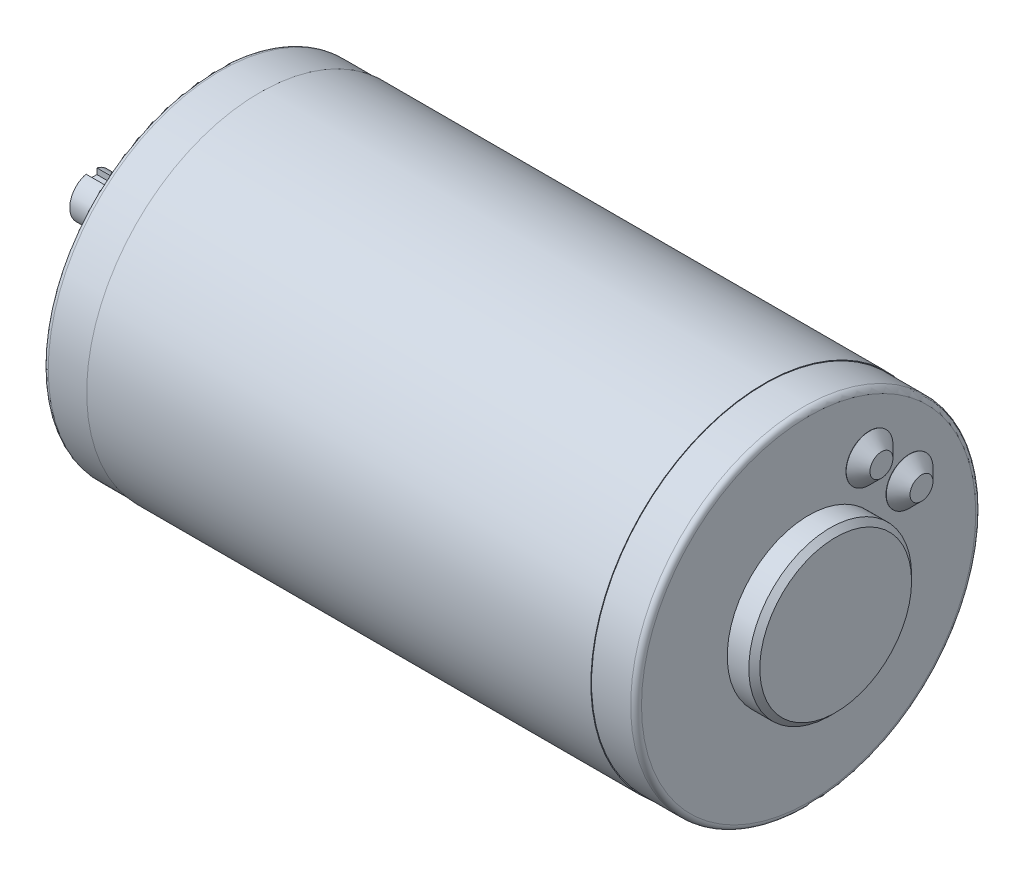
from build123d import *

# Parameters (mm, degrees)
SKETCH1_W                  = 93.1408
SKETCH1_H                  = 32.004
SKETCH2_R                  = 31.877
BOSS_EXTRUDE1_DEPTH        = 8.2296
SKETCH3_R                  = 15.0368
BOSS_EXTRUDE2_DEPTH        = 3.984
SKETCH4_R                  = 15.0368
BOSS_EXTRUDE3_DEPTH        = 1.016
BOSS_EXTRUDE3_TAPER        = 45
BOSS_EXTRUDE4_START        = 8.2296
SKETCH5_R                  = 31.877
BOSS_EXTRUDE4_DEPTH        = 8.2296
SKETCH6_R                  = 9.525
BOSS_EXTRUDE5_DEPTH        = 4
SKETCH7_R                  = 4
BOSS_EXTRUDE6_DEPTH        = 31.6
CUT_EXTRUDE1_REACH         = 125.971
CUT_EXTRUDE1_END_RADIUS    = 4
M3_5_CLEARANCE_HOLE1_D     = 4.0386
M3_5_CLEARANCE_HOLE1_DEPTH = 13.6144
M3_5_CLEARANCE_HOLE1_TIP   = 1.213317848
CHAMFER1_SIZE              = 1.016
CHAMFER2_SIZE              = 0.5
FILLET1_R                  = 1
CUT_EXTRUDE2_DEPTH         = 124.213928007
CUT_EXTRUDE2_DEPTH_BACK    = 124.213928007
SKETCH13_W                 = 12.7
SKETCH13_H                 = 41.153791371


with BuildPart() as part:
    # Sketch1 → Revolve1 (revolve)
    with BuildSketch(Plane.XY, mode=Mode.PRIVATE) as revolve1_sk:
        with Locations((54.8, 16.002)):
            Rectangle(SKETCH1_W, SKETCH1_H)
    revolve(revolve1_sk.sketch.rotate(Axis((8.2296, 0, 0), (1, 0, 0)), 270), axis=Axis((8.2296, 0, 0), (1, 0, 0)))

    # Sketch2 → Boss-Extrude1 (add)
    with BuildSketch(Plane(origin=(101.3704, 0, 0), x_dir=(0, 0, -1), z_dir=(1, 0, 0))):
        Circle(SKETCH2_R)
    extrude(amount=BOSS_EXTRUDE1_DEPTH)

    # Sketch3 → Boss-Extrude2 (add)
    with BuildSketch(Plane(origin=(109.6, 0, 0), x_dir=(0, 0, -1), z_dir=(1, 0, 0))):
        Circle(SKETCH3_R)
    extrude(amount=BOSS_EXTRUDE2_DEPTH)

    # Sketch4 → Boss-Extrude3 (add)
    with BuildSketch(Plane(origin=(113.584, 0, 0), x_dir=(0, 0, -1), z_dir=(1, 0, 0))):
        Circle(SKETCH4_R)
    extrude(amount=BOSS_EXTRUDE3_DEPTH, taper=BOSS_EXTRUDE3_TAPER)

    # Sketch5 → Boss-Extrude4 (add)
    with BuildSketch(Plane.ZY.offset(-8.2296).offset(BOSS_EXTRUDE4_START)):
        with Locations(Location((0, 0, 0), (0, 0, 180))):
            Circle(SKETCH5_R)
    extrude(amount=-BOSS_EXTRUDE4_DEPTH)

    # Sketch6 → Boss-Extrude5 (add)
    with BuildSketch(Plane.ZY):
        Circle(SKETCH6_R)
    extrude(amount=BOSS_EXTRUDE5_DEPTH)

    # Sketch7 → Boss-Extrude6 (add)
    with BuildSketch(Plane.ZY.offset(4)):
        Circle(SKETCH7_R)
    extrude(amount=BOSS_EXTRUDE6_DEPTH)

    # Cut-Extrude1: up to this cylinder (the profile starts inside it)
    cut_extrude1_end = Plane(origin=(-16.85, 0, 0), z_dir=(1, 0, 0)) * Cylinder(CUT_EXTRUDE1_END_RADIUS, 260.942, mode=Mode.PRIVATE)
    # Sketch8 → Cut-Extrude1 (cut, up to the surface)
    with BuildSketch(Plane.XZ.offset(-2.8), mode=Mode.PRIVATE) as cut_extrude1_sk1:
        with BuildLine():
            Line((-7.1, 1), (-26.6, 1))
            ThreePointArc((-26.6, 1), (-27.6, 0), (-26.6, -1))
            Line((-26.6, -1), (-7.1, -1))
            ThreePointArc((-7.1, -1), (-6.1, 0), (-7.1, 1))
        make_face()
    cut_extrude1_tool1 = extrude(cut_extrude1_sk1.sketch, amount=-CUT_EXTRUDE1_REACH, mode=Mode.PRIVATE) & cut_extrude1_end
    add(cut_extrude1_tool1.solids().sort_by_distance((-16.85, 2.8, 0))[0], mode=Mode.SUBTRACT)

    # Sketch9 → Revolve2 (revolve)
    with BuildSketch(Plane.XY.offset(-18.607090683), mode=Mode.PRIVATE) as revolve2_sk:
        Polygon((109.6, 15.525359639), (109.6, 11.207359639), (111.8479, 11.207359639), (111.8479, 13.325359639), (109.6479, 15.525359639), align=None)
    revolve(revolve2_sk.sketch.rotate(Axis((109.6, 11.207359639, -18.607090683), (1, 0, 0)), 270), axis=Axis((109.6, 11.207359639, -18.607090683), (1, 0, 0)))

    # Sketch10 → Revolve3 (revolve)
    with BuildSketch(Plane.XY.offset(-11.207359639), mode=Mode.PRIVATE) as revolve3_sk:
        Polygon((109.6, 22.925090683), (109.6, 18.607090683), (111.8479, 18.607090683), (111.8479, 20.725090683), (109.6479, 22.925090683), align=None)
    revolve(revolve3_sk.sketch.rotate(Axis((109.6, 18.607090683, -11.207359639), (1, 0, 0)), 270), axis=Axis((109.6, 18.607090683, -11.207359639), (1, 0, 0)))

    # M3.5 Clearance Hole1
    with Locations(Plane.ZY):
        with Locations((0, 25.4), (0, -25.4)):
            Hole(M3_5_CLEARANCE_HOLE1_D / 2, depth=M3_5_CLEARANCE_HOLE1_DEPTH)
            with Locations((0, 0, -(M3_5_CLEARANCE_HOLE1_DEPTH + M3_5_CLEARANCE_HOLE1_TIP / 2))):  # 118° drill point
                Cone(0, M3_5_CLEARANCE_HOLE1_D / 2, M3_5_CLEARANCE_HOLE1_TIP, mode=Mode.SUBTRACT)

    # Chamfer1
    chamfer1_edges = [part.edges().sort_by_distance(p)[0] for p in [
        (-4, 0, -9.525),
    ]]
    chamfer(chamfer1_edges, length=CHAMFER1_SIZE)

    # Chamfer2
    chamfer2_edges = [part.edges().sort_by_distance(p)[0] for p in [
        (-35.6, 0, -4),
    ]]
    chamfer(chamfer2_edges, length=CHAMFER2_SIZE)

    # Fillet1
    fillet1_edges = [part.edges().sort_by_distance(p)[0] for p in [
        (0, 0, 31.877),
        (109.6, 0, 31.877),
    ]]
    fillet(fillet1_edges, radius=FILLET1_R)

    # Sketch13 → Cut-Extrude2 (cut, two sides: drawn at the far end of the back side and taken through both)
    with BuildSketch(Plane(origin=(0, 0, 0), x_dir=(1, 0, 0), z_dir=(0, 1, 0)).offset(-CUT_EXTRUDE2_DEPTH_BACK)):
        with Locations((-29.25, 3.599946583)):
            Rectangle(SKETCH13_W, SKETCH13_H)
    extrude(amount=CUT_EXTRUDE2_DEPTH + CUT_EXTRUDE2_DEPTH_BACK, mode=Mode.SUBTRACT)


solid = part.part
